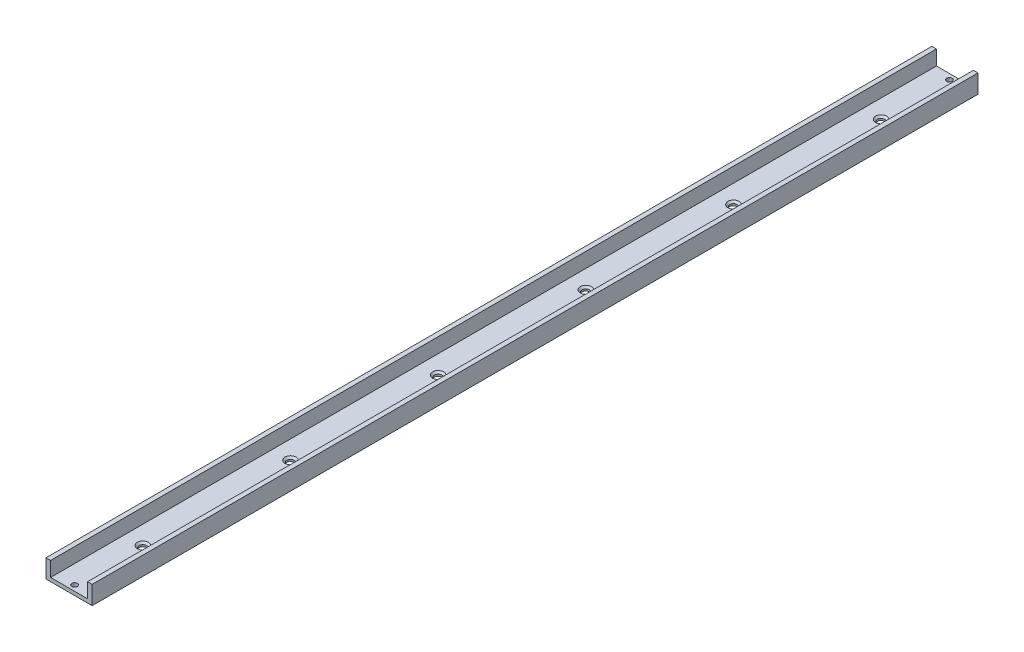
from build123d import *

# Parameters (mm, degrees)
EXTRUDE_1_DEPTH     = 480
SKETCH_2_R          = 1.5
SKETCH_2_R_2        = 2
CUT_EXTRUDE_1_DEPTH = 481.59364332
CHAMFER_1_SIZE      = 1


with BuildPart() as part:
    # ｽｹｯﾁ1 → ﾎﾞｽ - 押し出し1 (new body)
    with BuildSketch(Plane.XY):
        Polygon((0, 8), (-2.5, 8), (-2.5, -2), (22.5, -2), (22.5, 8), (20, 8), (20, 0), (0, 0), align=None)
    extrude(amount=EXTRUDE_1_DEPTH)

    # ｽｹｯﾁ2 → ｶｯﾄ - 押し出し1 (cut, through all)
    with BuildSketch(Plane(origin=(0, 0, 0), x_dir=(1, 0, 0), z_dir=(0, 1, 0))):
        with Locations(Location((10, -477, 0), (0, 0, 270))):
            Circle(SKETCH_2_R)
        with Locations(Location((10, -440, 0), (0, 0, 270))):
            Circle(SKETCH_2_R_2)
        with Locations(Location((10, -360, 0), (0, 0, 270))):
            Circle(SKETCH_2_R_2)
        with Locations(Location((10, -280, 0), (0, 0, 270))):
            Circle(SKETCH_2_R_2)
        with Locations(Location((10, -200, 0), (0, 0, 270))):
            Circle(SKETCH_2_R_2)
        with Locations(Location((10, -120, 0), (0, 0, 270))):
            Circle(SKETCH_2_R_2)
        with Locations(Location((10, -40, 0), (0, 0, 270))):
            Circle(SKETCH_2_R_2)
        with Locations(Location((10, -3, 0), (0, 0, 270))):
            Circle(SKETCH_2_R)
    extrude(amount=-CUT_EXTRUDE_1_DEPTH, mode=Mode.SUBTRACT)

    # 面取り1
    chamfer_1_edges = [part.edges().sort_by_distance(p)[0] for p in [
        (10, 0, 438),
        (10, 0, 358),
        (10, 0, 278),
        (10, 0, 198),
        (10, 0, 118),
        (10, 0, 38),
    ]]
    chamfer(chamfer_1_edges, length=CHAMFER_1_SIZE)


solid = part.part
